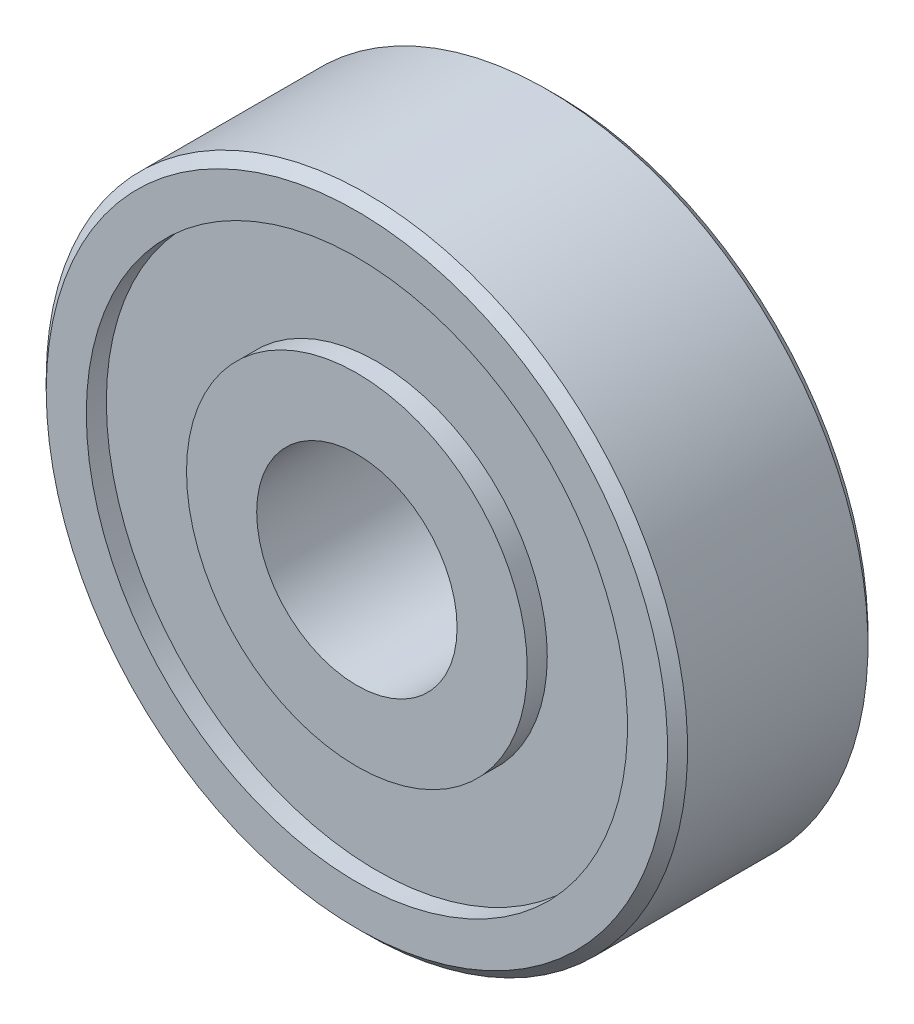
from build123d import *


with BuildPart() as part:
    # Sketch1 → Revolve1 (revolve)
    with BuildSketch(Plane.XZ, mode=Mode.PRIVATE) as revolve1_sk:
        Polygon((6.5, 2.25), (6.25, 2.5), (5.25, 2.5), (5.25, 2), (2.75, 2), (2.75, 2.5), (1, 2.5), (1, -2.5), (2.75, -2.5), (2.75, -2), (5.25, -2), (5.25, -2.5), (6.25, -2.5), (6.5, -2.25), align=None)
    revolve(revolve1_sk.sketch.rotate(Axis((-1.5, 0, 2.5), (0, 0, -1)), 180), axis=Axis((-1.5, 0, 2.5), (0, 0, -1)))


solid = part.part
